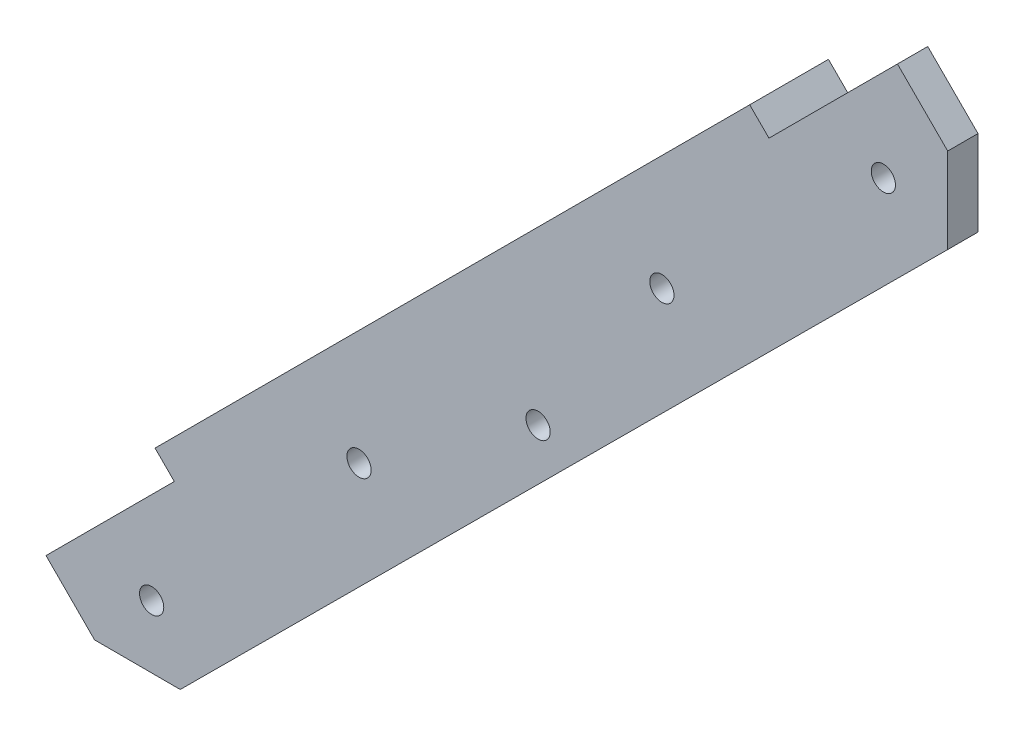
from build123d import *
from OCP.BRepFilletAPI import BRepFilletAPI_MakeChamfer

# Parameters (mm, degrees)
BOSS_EXTRUDE1_DEPTH = 5
SKETCH2_R           = 2
CUT_EXTRUDE1_DEPTH  = 15
BOSS_EXTRUDE2_DEPTH = 8
CHAMFER1_SIZE       = 10
CHAMFER1_SIZE2      = 9.982043079
CUT_EXTRUDE2_REACH  = 229.165
SKETCH4_R           = 2
SKETCH5_R           = 4
CUT_EXTRUDE3_DEPTH  = 3
CUT_EXTRUDE4_DEPTH  = 7
SKETCH7_R           = 2
CUT_EXTRUDE5_DEPTH  = 17


with BuildPart() as part:
    # Sketch1 → Boss-Extrude1 (new body)
    with BuildSketch(Plane.XY):
        Polygon((46.646446609, 27), (145, 125.000009716), (166.251364342, 146.174983473), (150.895154423, 161.531193392), (129.681985373, 140.318024342), (126.500004858, 143.500004858), (28.323223305, 45.323223305), (31.50520382, 42.141242789), (10.319228506, 20.955267476), (25.395082268, 5.825026243), align=None)
    extrude(amount=BOSS_EXTRUDE1_DEPTH)

    # Sketch2 → Cut-Extrude1 (cut)
    with BuildSketch(Plane.XY.offset(5)):
        with Locations((27.762116716, 23.256912896)):
            Circle(SKETCH2_R)
        with Locations((148.566315267, 144.061111447)):
            Circle(SKETCH2_R)
    extrude(amount=-CUT_EXTRUDE1_DEPTH, mode=Mode.SUBTRACT)

    # Sketch3 → Boss-Extrude2 (add)
    with BuildSketch(Plane(origin=(0, 0, 0), x_dir=(-1, 0, 0), z_dir=(0, 0, -1))):
        Polygon((-28.323223305, 45.323223305), (-46.613395502, 26.967067699), (-145, 125.000009716), (-126.500004858, 143.500004858), align=None)
    extrude(amount=BOSS_EXTRUDE2_DEPTH)

    # Chamfer1: one chamfer whose edges measure the first distance from different faces: ONE call of the kernel's chamfer builder (chamfer() names one face for all edges)
    chamfer1_edges_1 = [part.edges().sort_by_distance(p)[0] for p in [
        (25.395082268, 5.825026243, 2.5),
    ]]
    chamfer1_edges_2 = [part.edges().sort_by_distance(p)[0] for p in [
        (166.251364342, 146.174983473, 2.5),
    ]]
    chamfer1_side_2 = [part.faces().sort_by_distance(p)[0] for p in [
        (95.814501721, 75.991314625, -0.930462506),
    ]]
    chamfer1 = BRepFilletAPI_MakeChamfer(part.part.solid().wrapped)
    for e in chamfer1_edges_1:
        chamfer1.Add(CHAMFER1_SIZE, e.wrapped)
    for e in chamfer1_edges_2:
        chamfer1.Add(CHAMFER1_SIZE, CHAMFER1_SIZE2, e.wrapped, chamfer1_side_2[0].wrapped)  # the first distance lies on this face
    add(Compound.cast(chamfer1.Shape()), mode=Mode.REPLACE)

    # Sketch4 → Cut-Extrude2 (cut, up to next)
    with BuildSketch(Plane.XY.offset(5), mode=Mode.PRIVATE) as cut_extrude2_sk1:
        with Locations((62, 60)):
            Circle(SKETCH4_R)
    cut_extrude2_tool1 = extrude(cut_extrude2_sk1.sketch, amount=-CUT_EXTRUDE2_REACH, mode=Mode.PRIVATE) & part.part
    # Sketch4 → Cut-Extrude2 (cut, up to next)
    with BuildSketch(Plane.XY.offset(5), mode=Mode.PRIVATE) as cut_extrude2_sk2:
        with Locations((112, 110)):
            Circle(SKETCH4_R)
    cut_extrude2_tool2 = extrude(cut_extrude2_sk2.sketch, amount=-CUT_EXTRUDE2_REACH, mode=Mode.PRIVATE) & part.part
    add(cut_extrude2_tool1.solids().sort_by_distance((62, 60, 5))[0], mode=Mode.SUBTRACT)
    add(cut_extrude2_tool2.solids().sort_by_distance((112, 110, 5))[0], mode=Mode.SUBTRACT)

    # Sketch5 → Cut-Extrude3 (cut)
    with BuildSketch(Plane(origin=(0, 0, -8), x_dir=(-1, 0, 0), z_dir=(0, 0, -1))):
        with Locations(Location((-62, 60, 0), (0, 0, 90))):
            Circle(SKETCH5_R)
        with Locations(Location((-112, 110, 0), (0, 0, 90))):
            Circle(SKETCH5_R)
    extrude(amount=-CUT_EXTRUDE3_DEPTH, mode=Mode.SUBTRACT)

    # Sketch6 → Cut-Extrude4 (cut)
    with BuildSketch(Plane(origin=(0, 0, -8), x_dir=(-1, 0, 0), z_dir=(0, 0, -1))):
        Polygon((-92.220395862, 89.367799567), (-105.604656722, 85.781497678), (-109.190958611, 72.397236819), (-99.39299964, 62.599277847), (-86.00873878, 66.185579736), (-82.422436891, 79.569840596), align=None)
    extrude(amount=-CUT_EXTRUDE4_DEPTH, mode=Mode.SUBTRACT)

    # Sketch7 → Cut-Extrude5 (cut)
    with BuildSketch(Plane(origin=(0, 0, -1), x_dir=(-1, 0, 0), z_dir=(0, 0, -1))):
        with Locations(Location((-91.564057064, 80.226179394, 0), (0, 0, 90))):
            Circle(SKETCH7_R)
    extrude(amount=-CUT_EXTRUDE5_DEPTH, mode=Mode.SUBTRACT)


solid = part.part
